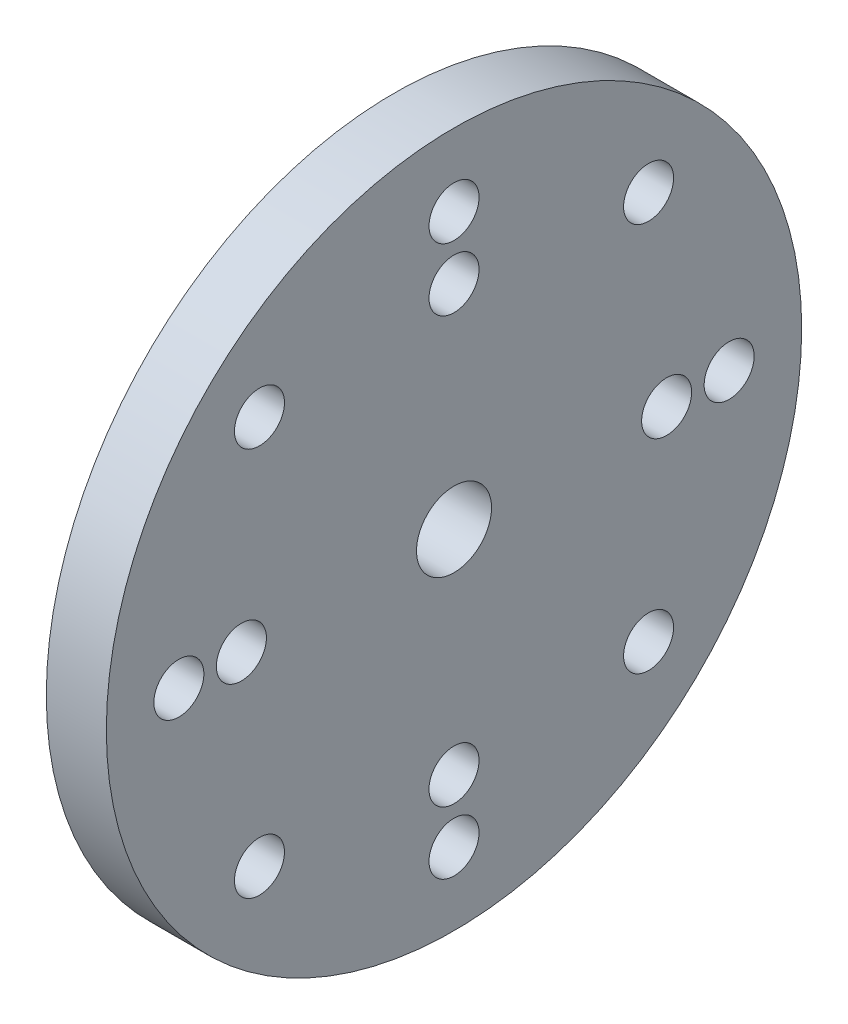
from build123d import *

# Parameters (mm, degrees)
SKETCH2_R          = 1
CUT_EXTRUDE1_DEPTH = 10
SKETCH3_R          = 1
CUT_EXTRUDE2_DEPTH = 10
CIRPATTERN1_COUNT  = 8
CIRPATTERN2_COUNT  = 4
SKETCH5_R          = 1.5
CUT_EXTRUDE3_DEPTH = 10


with BuildPart() as part:
    # Sketch1 → Revolve1 (revolve)
    with BuildSketch(Plane.XY, mode=Mode.PRIVATE) as revolve1_sk:
        Polygon((0, 0), (0, 4.95), (2, 4.95), (2, 13.9), (4.4, 13.9), (4.4, 0), align=None)
    revolve(revolve1_sk.sketch.rotate(Axis((0, 0, 0), (1, 0, 0)), 90), axis=Axis((0, 0, 0), (1, 0, 0)))

    # Sketch2 → Cut-Extrude1 (cut)
    with BuildSketch(Plane(origin=(4.4, 0, 0), x_dir=(0, 0, -1), z_dir=(1, 0, 0))):
        with Locations((0, 11)):
            Circle(SKETCH2_R)
    cut_extrude1 = extrude(amount=-CUT_EXTRUDE1_DEPTH, mode=Mode.SUBTRACT)

    # Sketch3 → Cut-Extrude2 (cut)
    with BuildSketch(Plane(origin=(4.4, 0, 0), x_dir=(0, 0, -1), z_dir=(1, 0, 0))):
        with Locations((0, 8.5)):
            Circle(SKETCH3_R)
    cut_extrude2 = extrude(amount=-CUT_EXTRUDE2_DEPTH, mode=Mode.SUBTRACT)

    # CirPattern1: Cut-Extrude1 ×8 about axis
    cirpattern1_axis = Axis((0, 0, 0), (1, 0, 0))
    for i in range(1, CIRPATTERN1_COUNT):
        add(cut_extrude1.rotate(cirpattern1_axis, i * 360 / CIRPATTERN1_COUNT), mode=Mode.SUBTRACT)

    # CirPattern2: Cut-Extrude2 ×4 about axis
    cirpattern2_axis = Axis((0, 0, 0), (1, 0, 0))
    for i in range(1, CIRPATTERN2_COUNT):
        add(cut_extrude2.rotate(cirpattern2_axis, i * 360 / CIRPATTERN2_COUNT), mode=Mode.SUBTRACT)

    # Sketch5 → Cut-Extrude3 (cut)
    with BuildSketch(Plane(origin=(4.4, 0, 0), x_dir=(0, 0, -1), z_dir=(1, 0, 0))):
        Circle(SKETCH5_R)
    extrude(amount=-CUT_EXTRUDE3_DEPTH, mode=Mode.SUBTRACT)


solid = part.part
